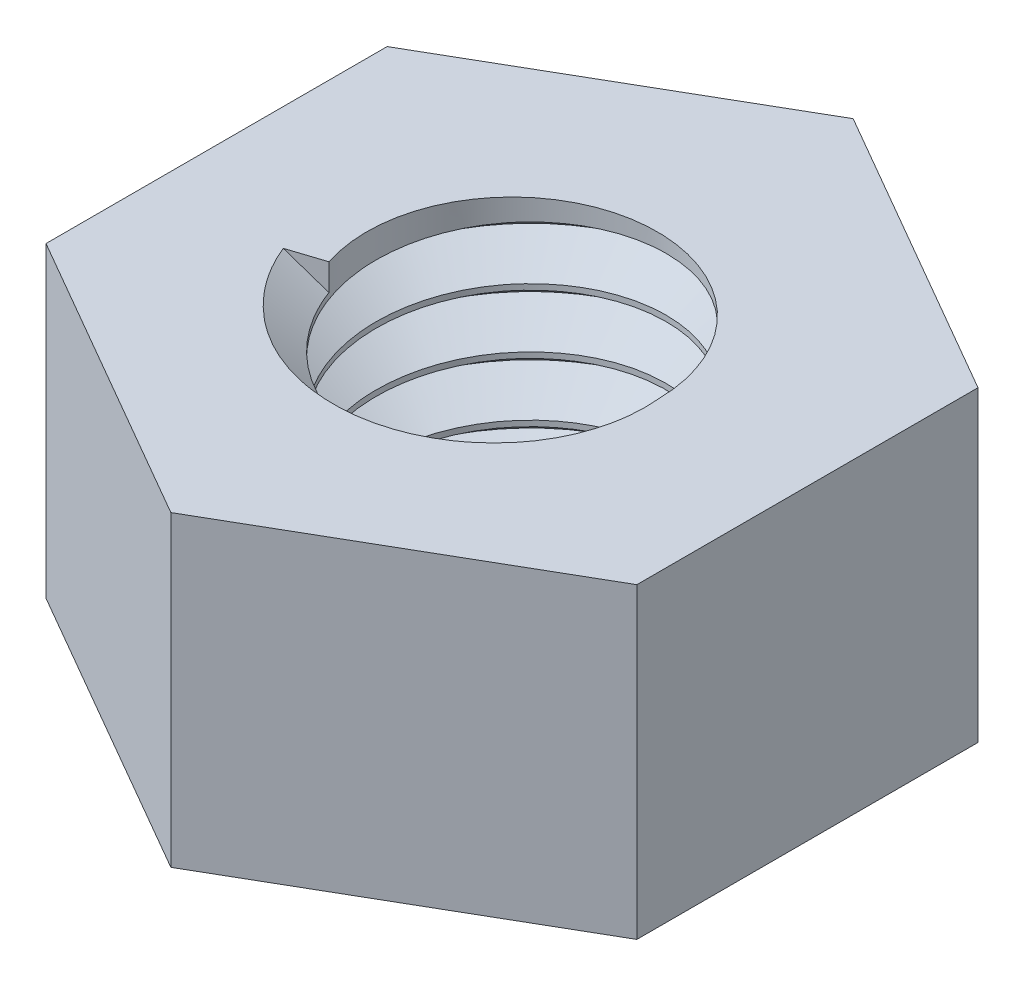
from build123d import *

# Parameters (mm, degrees)
HEXAGONO_DEPTH      = 5.2
TALADRO_PROFILE_R   = 2.45875
ROSCA_M6X1_0_PITCH  = 1
ROSCA_M6X1_0_HEIGHT = 5.2
ROSCA_M6X1_0_RADIUS = 2.4587


with BuildPart() as part:
    # Sk_Hexagono → Hexagono (new body)
    with BuildSketch(Plane(origin=(0, 0, 0), x_dir=(1, 0, 0), z_dir=(0, 1, 0))):
        Polygon((5, -2.886751346), (0, -5.773502692), (-5, -2.886751346), (-5, 2.886751346), (0, 5.773502692), (5, 2.886751346), align=None)
    extrude(amount=HEXAGONO_DEPTH)

    # Taladro: sweep along a curve in space
    with BuildLine() as taladro_path:
        Line((0, -1, 0), (0, 6.2, 0))
    # Taladro profile (on start of the path) → Taladro (sweep, cut)
    with BuildSketch(Plane.ZX.offset(-1)):
        Circle(TALADRO_PROFILE_R)
    sweep(path=taladro_path.line, mode=Mode.SUBTRACT)

    # Rosca_M6x1,0: sweep along a helix
    with BuildLine() as rosca_m6x1_0_path:
        Helix(ROSCA_M6X1_0_PITCH, ROSCA_M6X1_0_HEIGHT, ROSCA_M6X1_0_RADIUS, center=(0, 0, 0), direction=(0, 1, 0), lefthand=True)
    # Sk_Perfil_rosca → Rosca_M6x1,0 (sweep, cut)
    with BuildSketch(Plane(origin=(0, 0, 0), x_dir=(0, 0, -1), z_dir=(1, 0, 0))):
        Polygon((-2.2587, -0.6), (-3.0721, 0), (-2.2587, 0.6), align=None)
    sweep(path=rosca_m6x1_0_path.line, is_frenet=True, mode=Mode.SUBTRACT)


solid = part.part
